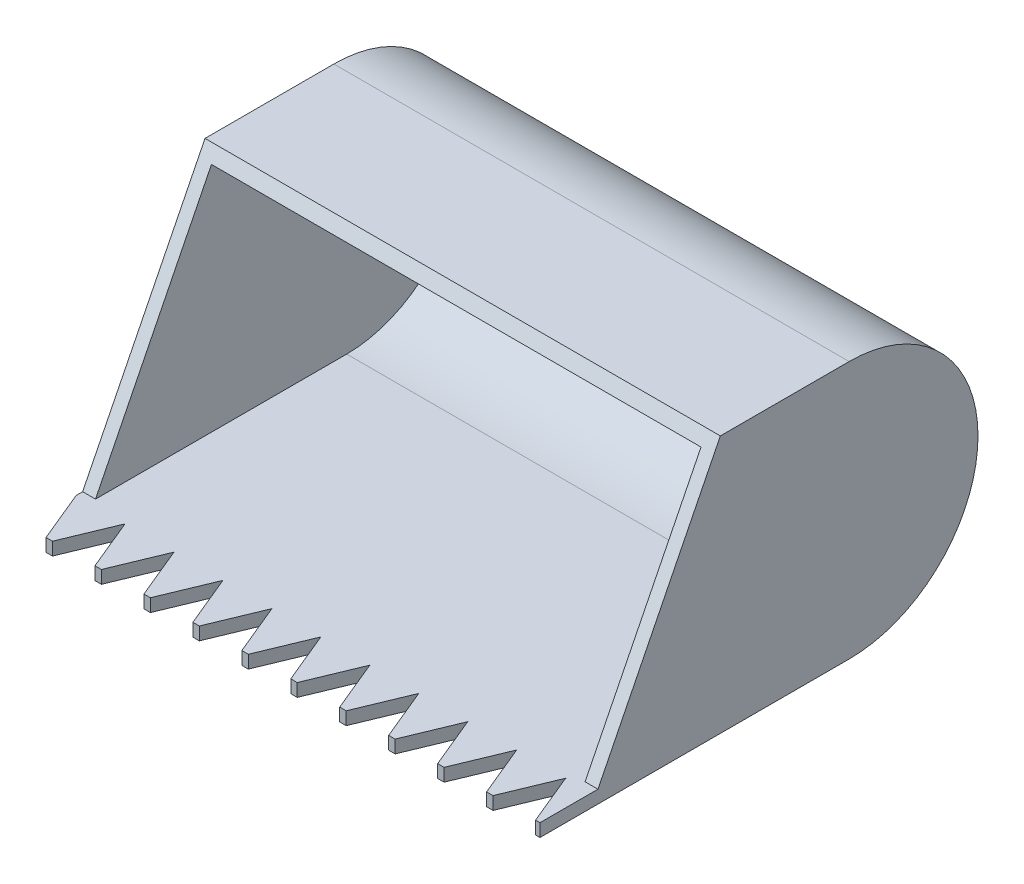
from build123d import *

# Parameters (mm, degrees)
SKETCH1_W           = 101.6
SKETCH1_H           = 50.8
BOSS_EXTRUDE1_DEPTH = 50.8
BOSS_EXTRUDE2_DEPTH = 101.6
CUT_EXTRUDE1_DEPTH  = 101.6
SHELL1_T            = -2.54
SKETCH4_W           = 101.6
SKETCH4_H           = 2.54
BOSS_EXTRUDE3_DEPTH = 12.7
CUT_EXTRUDE2_DEPTH  = 2.54
LPATTERN1_COUNT     = 11
LPATTERN1_PITCH     = 9.652


with BuildPart() as part:
    # Sketch1 → Boss-Extrude1 (new body)
    with BuildSketch(Plane.XY):
        with Locations((50.8, 25.4)):
            Rectangle(SKETCH1_W, SKETCH1_H)
    extrude(amount=-BOSS_EXTRUDE1_DEPTH)

    # Sketch2 → Boss-Extrude2 (add)
    with BuildSketch(Plane.ZY):
        with BuildLine():
            Line((-50.8, 50.8), (-50.8, 0))
            ThreePointArc((-50.8, 0), (-76.2, 25.4), (-50.8, 50.8))
        make_face()
    extrude(amount=-BOSS_EXTRUDE2_DEPTH)

    # Sketch3 → Cut-Extrude1 (cut)
    with BuildSketch(Plane.ZY):
        Polygon((0, 0), (-25.4, 50.8), (0, 50.8), align=None)
    extrude(amount=-CUT_EXTRUDE1_DEPTH, mode=Mode.SUBTRACT)

    # Shell1
    shell1_openings = [part.faces().sort_by_distance(p)[0] for p in [
        (50.8, 25.4, -12.7),
    ]]
    offset(amount=SHELL1_T, openings=shell1_openings, kind=Kind.INTERSECTION)

    # Sketch4 → Boss-Extrude3 (add)
    with BuildSketch(Plane.XY.offset(-2.54)):
        with Locations((50.8, 1.27)):
            Rectangle(SKETCH4_W, SKETCH4_H)
    extrude(amount=BOSS_EXTRUDE3_DEPTH)

    # Sketch5 → Cut-Extrude2 (cut)
    with BuildSketch(Plane(origin=(0, 2.54, 0), x_dir=(1, 0, 0), z_dir=(0, 1, 0))):
        Polygon((0, 0), (4.208409794, -10.16), (0, -10.16), align=None)
        Polygon((5.478409794, -10.16), (9.686819587, 0), (9.686819587, -10.16), align=None)
    cut_extrude2 = extrude(amount=-CUT_EXTRUDE2_DEPTH, mode=Mode.SUBTRACT)

    # LPattern1: Cut-Extrude2 ×11
    with Locations(*[(i * LPATTERN1_PITCH, 0, 0) for i in range(1, LPATTERN1_COUNT)]):
        add(cut_extrude2, mode=Mode.SUBTRACT)


solid = part.part
